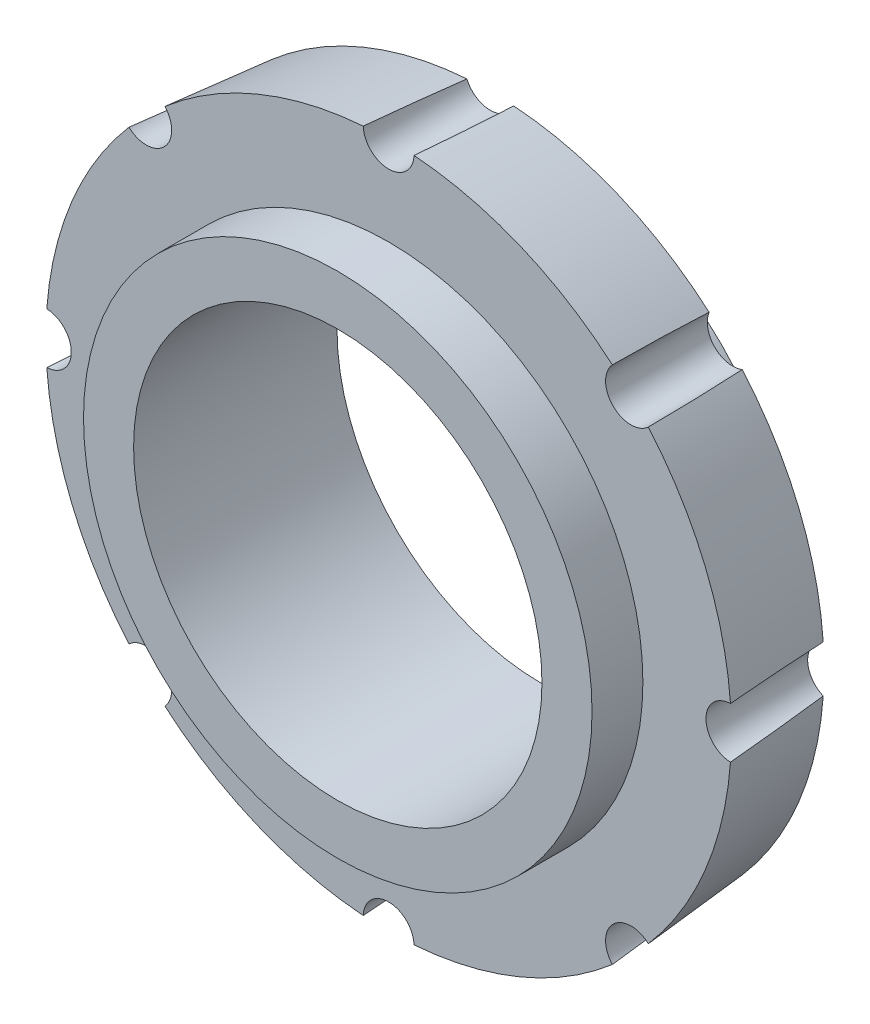
from build123d import *

# Parameters (mm, degrees)
SKETCH2_R         = 1.5875
EXTRUDE1_DEPTH    = 32.728717878
CIRPATTERN1_COUNT = 8


with BuildPart() as part:
    # Sketch1 → Revolve1 (revolve)
    with BuildSketch(Plane(origin=(0, 0, 0), x_dir=(0, 0, -1), z_dir=(1, 0, 0)), mode=Mode.PRIVATE) as revolve1_sk:
        Polygon((0, 15.875), (0, 12.74826), (12.7, 12.74826), (12.7, 15.875), (9.525, 15.875), (9.525, 20.83308), (3.175, 21.40077), (3.175, 15.875), align=None)
    revolve(revolve1_sk.sketch.rotate(Axis((0, 0, 0), (0, 0, -1)), 90), axis=Axis((0, 0, 0), (0, 0, -1)))

    # Sketch2 → Extrude1 (cut, through all)
    with BuildSketch(Plane.XY.offset(-3.175)):
        with Locations((0, 21.40077)):
            Circle(SKETCH2_R)
    extrude1 = extrude(amount=-EXTRUDE1_DEPTH, mode=Mode.SUBTRACT)

    # CirPattern1: Extrude1 ×8 about axis
    cirpattern1_axis = Axis((0, 0, 0), (0, 0, 1))
    for i in range(1, CIRPATTERN1_COUNT):
        add(extrude1.rotate(cirpattern1_axis, i * 360 / CIRPATTERN1_COUNT), mode=Mode.SUBTRACT)


solid = part.part
